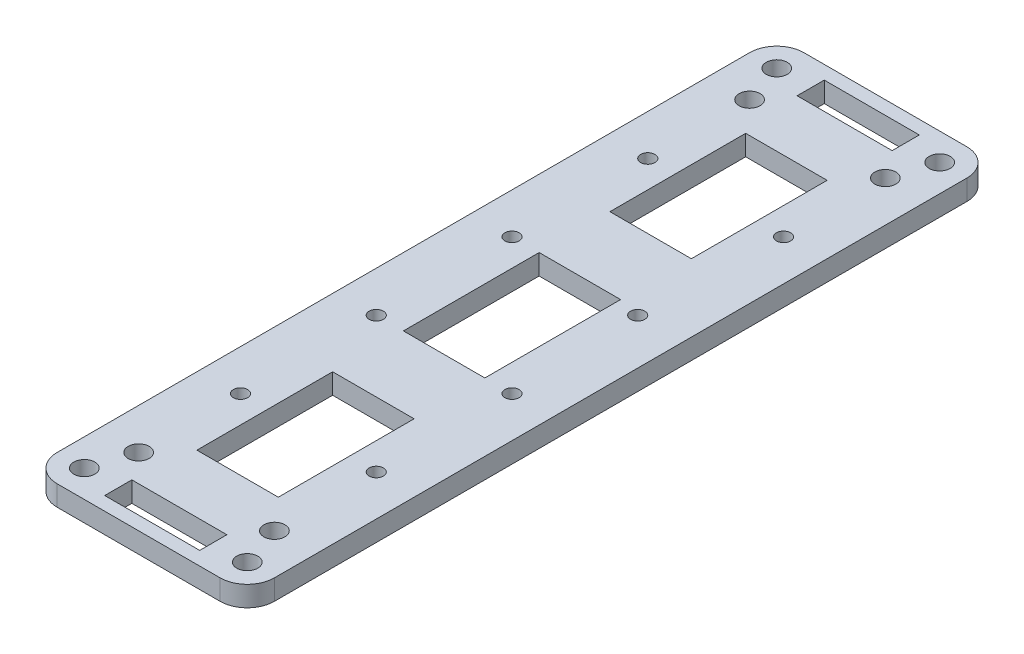
from build123d import *

# Parameters (mm, degrees)
SKETCH_1_R      = 1.05
SKETCH_1_R_2    = 1.55
SKETCH_1_W      = 12
SKETCH_1_H      = 20
SKETCH_1_W_2    = 14
SKETCH_1_H_2    = 4
EXTRUDE_1_DEPTH = 3


with BuildPart() as part:
    # 草图1 → 凸台-拉伸1 (new body)
    with BuildSketch(Plane(origin=(0, 0, 0), x_dir=(1, 0, 0), z_dir=(0, 1, 0))):
        with BuildLine():
            Line((-16, -37.476129922), (-16, -51))
            ThreePointArc((-16, -51), (-14.828427125, -53.828427125), (-12, -55))
            Line((-12, -55), (12, -55))
            ThreePointArc((12, -55), (14.828427125, -53.828427125), (16, -51))
            Line((16, -51), (16, -37.476129922))
            Line((16, -37.476129922), (16, 25.467140075))
            Line((16, 25.467140075), (16, 51))
            ThreePointArc((16, 51), (14.828427125, 53.828427125), (12, 55))
            Line((12, 55), (-12, 55))
            ThreePointArc((-12, 55), (-14.828427125, 53.828427125), (-16, 51))
            Line((-16, 51), (-16, 31.142350414))
            Line((-16, 31.142350414), (-16, -37.476129922))
        make_face()
        with Locations(Location((-10, 30, 0), (0, 0, 270))):
            Circle(SKETCH_1_R, mode=Mode.SUBTRACT)
        with Locations(Location((10, 30, 0), (0, 0, 270))):
            Circle(SKETCH_1_R, mode=Mode.SUBTRACT)
        with Locations(Location((-10, 10, 0), (0, 0, 270))):
            Circle(SKETCH_1_R, mode=Mode.SUBTRACT)
        with Locations(Location((10, -10, 0), (0, 0, 270))):
            Circle(SKETCH_1_R, mode=Mode.SUBTRACT)
        with Locations(Location((-10, -30, 0), (0, 0, 270))):
            Circle(SKETCH_1_R, mode=Mode.SUBTRACT)
        with Locations(Location((10, -30, 0), (0, 0, 270))):
            Circle(SKETCH_1_R, mode=Mode.SUBTRACT)
        with Locations(Location((10, -45, 0), (0, 0, 270))):
            Circle(SKETCH_1_R_2, mode=Mode.SUBTRACT)
        with Locations(Location((-10, -45, 0), (0, 0, 270))):
            Circle(SKETCH_1_R_2, mode=Mode.SUBTRACT)
        with Locations(Location((10, 45, 0), (0, 0, 270))):
            Circle(SKETCH_1_R_2, mode=Mode.SUBTRACT)
        with Locations(Location((-10, 45, 0), (0, 0, 270))):
            Circle(SKETCH_1_R_2, mode=Mode.SUBTRACT)
        with Locations(Location((9.25753788, 9.25753788, 0), (0, 0, 270))):
            Circle(SKETCH_1_R, mode=Mode.SUBTRACT)
        with Locations(Location((-10, -10, 0), (0, 0, 270))):
            Circle(SKETCH_1_R, mode=Mode.SUBTRACT)
        with Locations(Location((-12, 51, 0), (0, 0, 270))):
            Circle(SKETCH_1_R_2, mode=Mode.SUBTRACT)
        with Locations(Location((12, 51, 0), (0, 0, 270))):
            Circle(SKETCH_1_R_2, mode=Mode.SUBTRACT)
        with Locations(Location((-12, -51, 0), (0, 0, 270))):
            Circle(SKETCH_1_R_2, mode=Mode.SUBTRACT)
        with Locations(Location((12, -51, 0), (0, 0, 270))):
            Circle(SKETCH_1_R_2, mode=Mode.SUBTRACT)
        with Locations((0, 30.422470983)):
            Rectangle(SKETCH_1_W, SKETCH_1_H, mode=Mode.SUBTRACT)
        with Locations((0, 51)):
            Rectangle(SKETCH_1_W_2, SKETCH_1_H_2, mode=Mode.SUBTRACT)
        with Locations((0, -30.422470983)):
            Rectangle(SKETCH_1_W, SKETCH_1_H, mode=Mode.SUBTRACT)
        with Locations((0, -51)):
            Rectangle(SKETCH_1_W_2, SKETCH_1_H_2, mode=Mode.SUBTRACT)
        Rectangle(SKETCH_1_W, SKETCH_1_H, mode=Mode.SUBTRACT)
    extrude(amount=EXTRUDE_1_DEPTH)


solid = part.part
